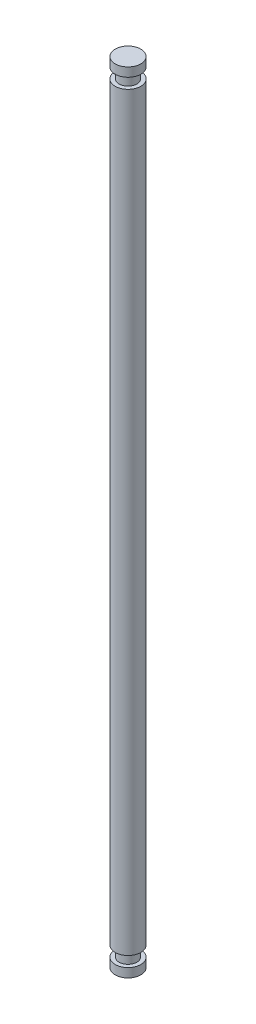
from build123d import *

# Parameters (mm, degrees)
CUT_EXTRUDE2_START = -928.2176
SKETCH2_W          = 63.4619
SKETCH2_H          = 12.7
CUT_EXTRUDE2_DEPTH = 1856.5622


with BuildPart() as part:
    # Sketch1 → Revolve1 (revolve)
    with BuildSketch(Plane(origin=(0, 0, 0), x_dir=(0, 1, 0), z_dir=(0, 0, 1)), mode=Mode.PRIVATE) as revolve1_sk:
        Polygon((-976.376, 0), (-976.376, 31.73095), (-954.024, 31.73095), (-954.024, 22.0218), (-928.2176, 22.0218), (-928.2176, 31.73095), (928.3446, 31.73095), (928.3446, 22.0218), (954.151, 22.0218), (954.151, 31.73095), (976.376, 31.73095), (976.376, 0), align=None)
    revolve(revolve1_sk.sketch.rotate(Axis((0, -1001.776, 0), (0, 1, 0)), 270), axis=Axis((0, -1001.776, 0), (0, 1, 0)))

    # Sketch2 → Cut-Extrude2 (cut)
    with BuildSketch(Plane(origin=(0, 0, 0), x_dir=(-1, 0, 0), z_dir=(0, 1, 0)).offset(CUT_EXTRUDE2_START)):
        with Locations((56.3372, 0)):
            Rectangle(SKETCH2_W, SKETCH2_H)
    extrude(amount=CUT_EXTRUDE2_DEPTH, mode=Mode.SUBTRACT)


solid = part.part
